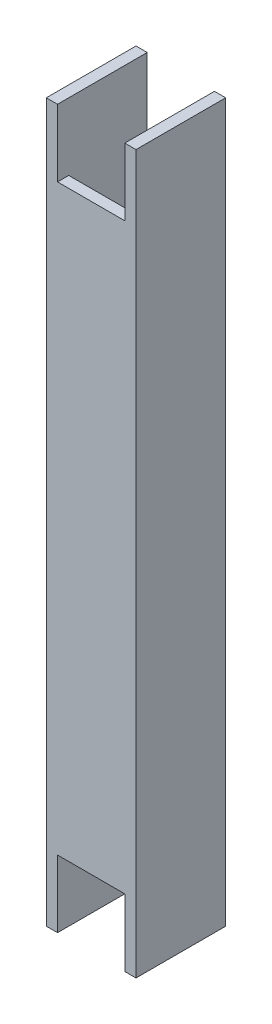
from build123d import *

# Parameters (mm, degrees)
SKETCH1_W           = 25.4
SKETCH1_H           = 25.4
SKETCH1_W_2         = 19.05
SKETCH1_H_2         = 19.05
EXTRUDE_THIN1_DEPTH = 203.2
SKETCH3_W           = 19.05
SKETCH3_H           = 19.05
CUT_EXTRUDE1_DEPTH  = 207.350575478
SKETCH4_W           = 19.05
SKETCH4_H           = 19.05
CUT_EXTRUDE2_DEPTH  = 207.350575478


with BuildPart() as part:
    # Sketch1 → Extrude-Thin1 (new body)
    with BuildSketch(Plane(origin=(0, 0, 0), x_dir=(1, 0, 0), z_dir=(0, 1, 0))):
        with Locations((12.7, 12.7)):
            Rectangle(SKETCH1_W, SKETCH1_H)
        with Locations((12.7, 12.7)):
            Rectangle(SKETCH1_W_2, SKETCH1_H_2, mode=Mode.SUBTRACT)
    extrude(amount=EXTRUDE_THIN1_DEPTH)

    # Sketch3 → Cut-Extrude1 (cut, through all)
    with BuildSketch(Plane.XY):
        with Locations((12.7, 193.675)):
            Rectangle(SKETCH3_W, SKETCH3_H)
    extrude(amount=-CUT_EXTRUDE1_DEPTH, mode=Mode.SUBTRACT)

    # Sketch4 → Cut-Extrude2 (cut, through all)
    with BuildSketch(Plane.XY):
        with Locations((12.7, 9.525)):
            Rectangle(SKETCH4_W, SKETCH4_H)
    extrude(amount=-CUT_EXTRUDE2_DEPTH, mode=Mode.SUBTRACT)


solid = part.part
